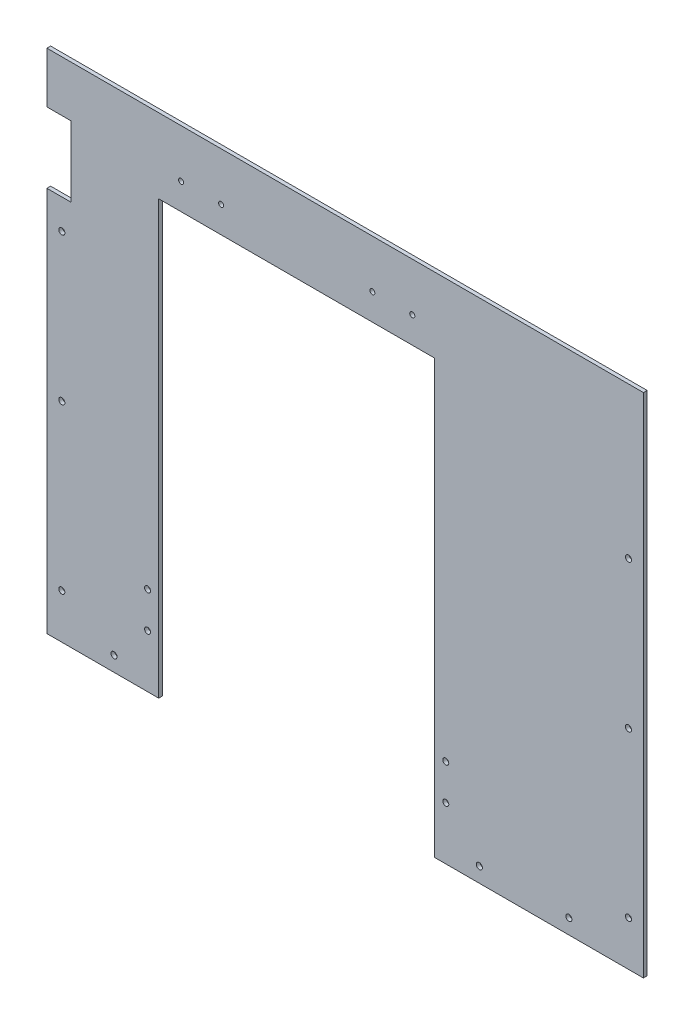
from build123d import *

# Parameters (mm, degrees)
SKETCH1_W           = 508
SKETCH1_H           = 508
BOSS_EXTRUDE1_DEPTH = 3.175
SKETCH2_R           = 2.54
SKETCH2_W           = 234.95
SKETCH2_H           = 368.3
CUT_EXTRUDE1_DEPTH  = 44.45
SKETCH4_R           = 2.159
CUT_EXTRUDE3_DEPTH  = 719.427505476
SKETCH5_R           = 2.6
CUT_EXTRUDE4_DEPTH  = 719.427505476
SKETCH6_W           = 20.6375
SKETCH6_H           = 119.54625
BOSS_EXTRUDE3_DEPTH = 3.175
SKETCH7_W           = 508
SKETCH7_H           = 76.2
CUT_EXTRUDE5_DEPTH  = 719.427505476


with BuildPart() as part:
    # Sketch1 → Boss-Extrude1 (new body)
    with BuildSketch(Plane.XY):
        with Locations((254, 254)):
            Rectangle(SKETCH1_W, SKETCH1_H)
    extrude(amount=BOSS_EXTRUDE1_DEPTH)

    # Sketch2 → Cut-Extrude1 (cut)
    with BuildSketch(Plane(origin=(0, 0, 0), x_dir=(-1, 0, 0), z_dir=(0, 0, -1))):
        with Locations((-339.725, 45.085)):
            Circle(SKETCH2_R)
        with Locations((-85.725, 45.085)):
            Circle(SKETCH2_R)
        with Locations((-339.725, 75.565)):
            Circle(SKETCH2_R)
        with Locations((-85.725, 75.565)):
            Circle(SKETCH2_R)
        with Locations((-212.725, 184.15)):
            Rectangle(SKETCH2_W, SKETCH2_H)
        Polygon((0, 403.06625), (0, 328.45375), (-20.6375, 328.45375), (-20.6375, 403.06625), (-20.6375, 508), (0, 508), align=None)
    extrude(amount=-CUT_EXTRUDE1_DEPTH, mode=Mode.SUBTRACT)

    # Sketch4 → Cut-Extrude3 (cut, through all)
    with BuildSketch(Plane(origin=(0, 0, 0), x_dir=(-1, 0, 0), z_dir=(0, 0, -1))):
        with Locations((-311.1754, 390.779)):
            Circle(SKETCH4_R)
        with Locations((-277.1394, 390.779)):
            Circle(SKETCH4_R)
        with Locations((-148.3614, 390.779)):
            Circle(SKETCH4_R)
        with Locations((-114.3254, 390.779)):
            Circle(SKETCH4_R)
    extrude(amount=-CUT_EXTRUDE3_DEPTH, mode=Mode.SUBTRACT)

    # Sketch5 → Cut-Extrude4 (cut, through all)
    with BuildSketch(Plane.XY.offset(3.175)):
        with Locations((12.7, 303.05375)):
            Circle(SKETCH5_R)
        with Locations((12.7, 177.8)):
            Circle(SKETCH5_R)
        with Locations((12.7, 38.1)):
            Circle(SKETCH5_R)
        with Locations((495.3, 38.1)):
            Circle(SKETCH5_R)
        with Locations((495.3, 177.8)):
            Circle(SKETCH5_R)
        with Locations((495.3, 303.05375)):
            Circle(SKETCH5_R)
        with Locations((495.3, 469.9)):
            Circle(SKETCH5_R)
        with Locations((57.15, 12.7)):
            Circle(SKETCH5_R)
        with Locations((368.3, 12.7)):
            Circle(SKETCH5_R)
        with Locations((444.5, 12.7)):
            Circle(SKETCH5_R)
        with Locations((33.3375, 495.3)):
            Circle(SKETCH5_R)
        with Locations((469.9, 495.3)):
            Circle(SKETCH5_R)
    extrude(amount=-CUT_EXTRUDE4_DEPTH, mode=Mode.SUBTRACT)

    # Sketch6 → Boss-Extrude3 (add)
    with BuildSketch(Plane.XY.offset(3.175)):
        with Locations((10.31875, 448.226875)):
            Rectangle(SKETCH6_W, SKETCH6_H)
    extrude(amount=-BOSS_EXTRUDE3_DEPTH)

    # Sketch7 → Cut-Extrude5 (cut, through all)
    with BuildSketch(Plane.XY.offset(3.175)):
        with Locations((254, 469.9)):
            Rectangle(SKETCH7_W, SKETCH7_H)
    extrude(amount=-CUT_EXTRUDE5_DEPTH, mode=Mode.SUBTRACT)


solid = part.part
